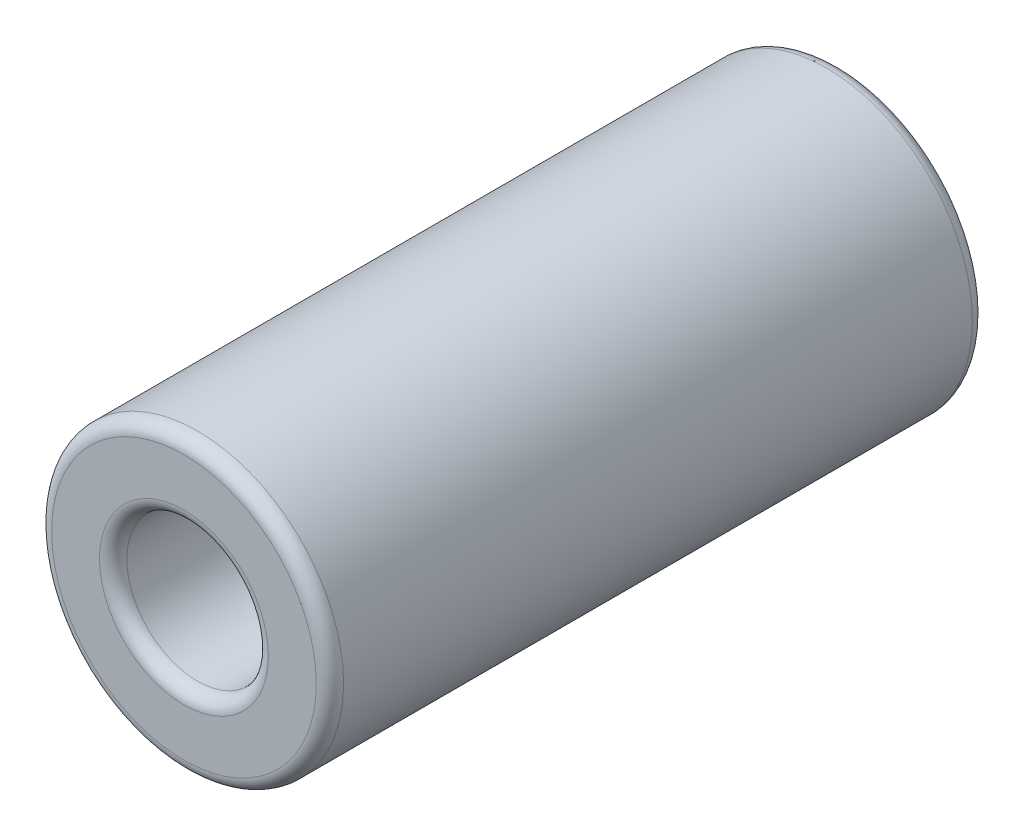
from build123d import *

# Parameters (mm, degrees)
SKETCH_1_R      = 7.475
SKETCH_1_R_2    = 3.625
EXTRUDE_1_DEPTH = 33.6
FILLET_1_R      = 0.7


with BuildPart() as part:
    # Эскиз1 → Вытянуть1 (new body)
    with BuildSketch(Plane.XY):
        Circle(SKETCH_1_R)
        Circle(SKETCH_1_R_2, mode=Mode.SUBTRACT)
    extrude(amount=EXTRUDE_1_DEPTH)

    # Скругление1
    fillet_1_edges = [part.edges().sort_by_distance(p)[0] for p in [
        (-7.475, 0, 0),
        (-7.475, 0, 33.6),
        (-3.625, 0, 0),
        (-3.625, 0, 33.6),
    ]]
    fillet(fillet_1_edges, radius=FILLET_1_R)


solid = part.part
